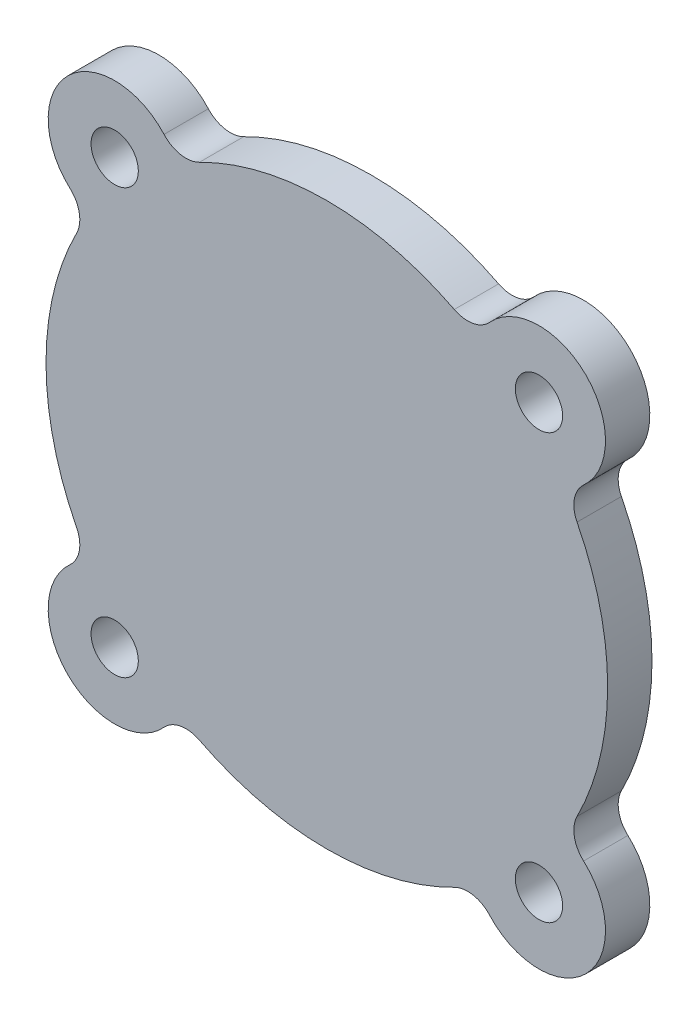
from build123d import *

# Parameters (mm, degrees)
SKETCH_1_R          = 19
EXTRUDE_1_DEPTH     = 3
SKETCH_2_R          = 15.8
SKETCH_2_R_2        = 11.7
CUT_EXTRUDE_1_DEPTH = 2.4
SKETCH_3_R          = 4.5
EXTRUDE_2_DEPTH     = 3
HOLE_WIZARD_M3_1_D  = 3.2
FILLET_1_R          = 2


with BuildPart() as part:
    # ｽｹｯﾁ1 → ﾎﾞｽ - 押し出し1 (new body)
    with BuildSketch(Plane.XY):
        Circle(SKETCH_1_R)
    extrude(amount=EXTRUDE_1_DEPTH)

    # ｽｹｯﾁ2 → ｶｯﾄ - 押し出し1 (cut)
    with BuildSketch(Plane(origin=(0, 0, 0), x_dir=(-1, 0, 0), z_dir=(0, 0, -1))):
        Circle(SKETCH_2_R)
        Circle(SKETCH_2_R_2, mode=Mode.SUBTRACT)
    extrude(amount=-CUT_EXTRUDE_1_DEPTH, mode=Mode.SUBTRACT)

    # ｽｹｯﾁ3 → ﾎﾞｽ - 押し出し2 (add)
    with BuildSketch(Plane.XY.offset(3)):
        with Locations((-14.354267658, 14.354267658)):
            Circle(SKETCH_3_R)
        with Locations((14.354267658, 14.354267658)):
            Circle(SKETCH_3_R)
        with Locations((14.354267658, -14.354267658)):
            Circle(SKETCH_3_R)
        with Locations((-14.354267658, -14.354267658)):
            Circle(SKETCH_3_R)
    extrude(amount=-EXTRUDE_2_DEPTH)

    # M3 すきま穴1 (through all)
    with Locations(Plane.XY.offset(3)):
        with Locations((-14.354267658, 14.354267658), (-14.354267658, -14.354267658), (14.354267658, 14.354267658), (14.354267658, -14.354267658)):
            Hole(HOLE_WIZARD_M3_1_D / 2)

    # ﾌｨﾚｯﾄ1
    fillet_1_edges = [part.edges().sort_by_distance(p)[0] for p in [
        (-10.182407316, 16.041152741, 1.5),
        (-16.041152741, 10.182407316, 1.5),
        (16.041152741, 10.182407316, 1.5),
        (10.182407316, 16.041152741, 1.5),
        (10.182407316, -16.041152741, 1.5),
        (16.041152741, -10.182407316, 1.5),
        (-16.041152741, -10.182407316, 1.5),
        (-10.182407316, -16.041152741, 1.5),
    ]]
    fillet(fillet_1_edges, radius=FILLET_1_R)


solid = part.part
